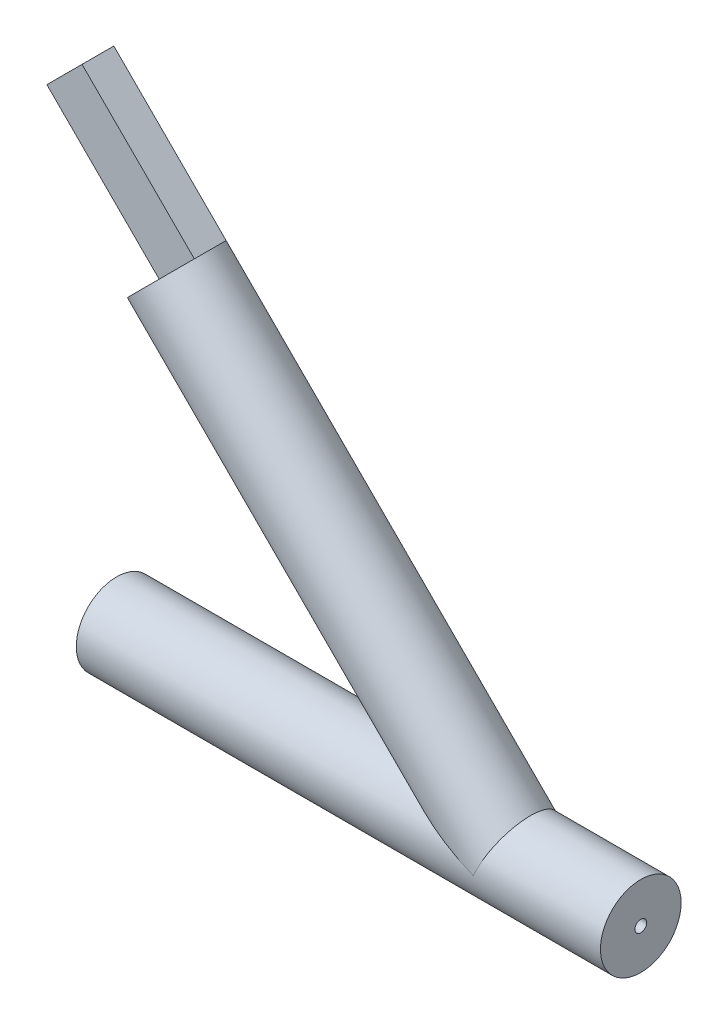
from build123d import *

# Parameters (mm, degrees)
SKETCH1_R           = 12.7
BOSS_EXTRUDE1_DEPTH = 165
SKETCH7_R           = 12.7
BOSS_EXTRUDE3_DEPTH = 150
SKETCH10_W          = 10
SKETCH10_H          = 15.657586021
BOSS_EXTRUDE8_DEPTH = 50
SKETCH11_R          = 1.85
CUT_EXTRUDE2_DEPTH  = 239.140019974


with BuildPart() as part:
    # Sketch1 → Boss-Extrude1 (new body)
    with BuildSketch(Plane(origin=(0, 0, 0), x_dir=(0, 0, -1), z_dir=(1, 0, 0))):
        Circle(SKETCH1_R)
    extrude(amount=BOSS_EXTRUDE1_DEPTH)

    # Sketch7 → Boss-Extrude3 (add)
    with BuildSketch(Plane(origin=(62.5, -62.5, 0), x_dir=(0.7071067811865464, 0.7071067811865488, 0), z_dir=(-0.7071067811865488, 0.7071067811865464, 0))):
        with Locations(Location((88.388347648, 0, 0), (0, 0, 90))):
            Circle(SKETCH7_R)
    extrude(amount=BOSS_EXTRUDE3_DEPTH)

    # Sketch10 → Boss-Extrude8 (add)
    with BuildSketch(Plane(origin=(-43.566017178, 43.566017178, 0), x_dir=(0, 0, 1), z_dir=(-0.7071067811865487, 0.7071067811865465, 0))):
        with Locations((-5, 88.388347649)):
            Rectangle(SKETCH10_W, SKETCH10_H)
    extrude(amount=BOSS_EXTRUDE8_DEPTH)

    # Sketch11 → Cut-Extrude2 (cut, through all)
    with BuildSketch(Plane(origin=(165, 0, 0), x_dir=(0, 0, -1), z_dir=(1, 0, 0))):
        Circle(SKETCH11_R)
    extrude(amount=-CUT_EXTRUDE2_DEPTH, mode=Mode.SUBTRACT)


solid = part.part
